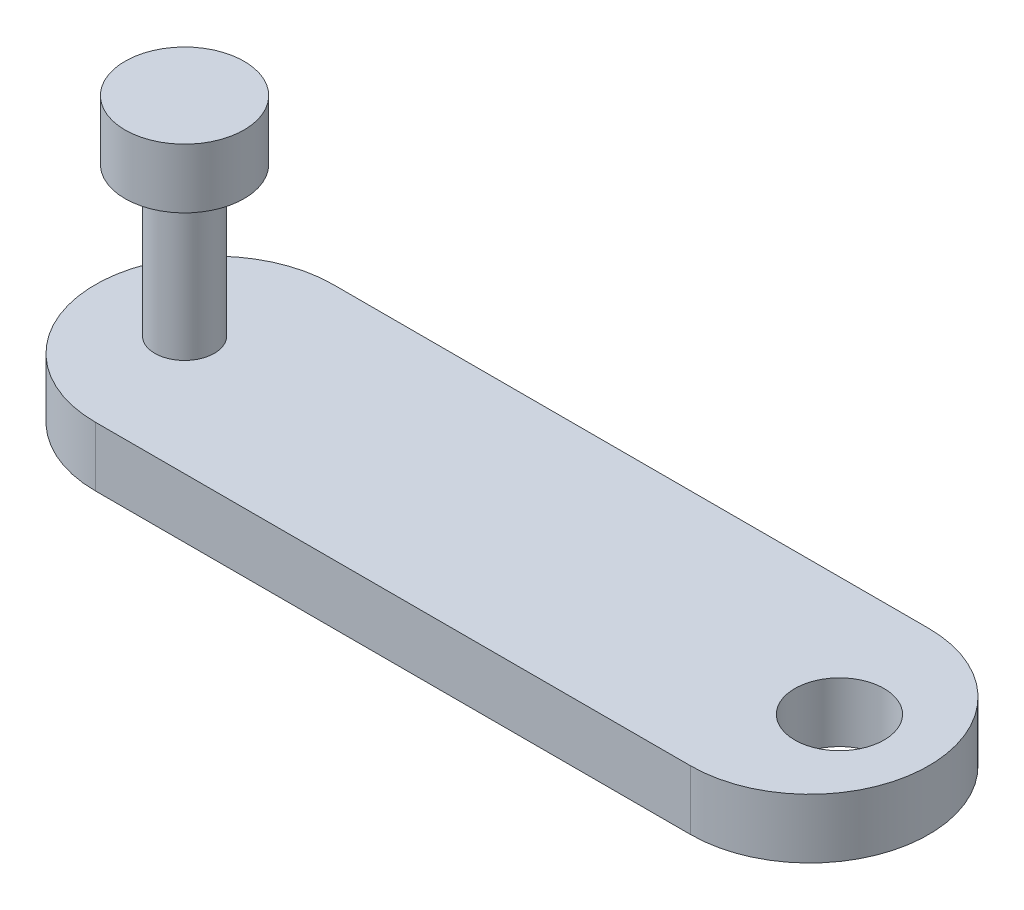
from build123d import *

# Parameters (mm, degrees)
BATON_DEPTH       = 2.54
SKETCH2_R         = 1.27
JOIN_DEPTH        = 6.35
SKETCH4_R         = 2.54
JOINER_CAP_DEPTH  = 2.54
SKETCH5_R         = 1.905
JOINER_HOLE_DEPTH = 2.54


with BuildPart() as part:
    # Sketch1 → baton (new body)
    with BuildSketch(Plane(origin=(0, 0, 0), x_dir=(1, 0, 0), z_dir=(0, 1, 0))):
        with BuildLine():
            Line((-12.7, 5.08), (12.7, 5.08))
            ThreePointArc((12.7, 5.08), (17.78, 0), (12.7, -5.08))
            Line((12.7, -5.08), (-12.7, -5.08))
            ThreePointArc((-12.7, -5.08), (-17.78, 0), (-12.7, 5.08))
        make_face()
    extrude(amount=BATON_DEPTH)

    # Sketch2 → join (add)
    with BuildSketch(Plane(origin=(0, 2.54, 0), x_dir=(1, 0, 0), z_dir=(0, 1, 0))):
        with Locations(Location((-13.97, 0, 0), (0, 0, 270))):
            Circle(SKETCH2_R)
    extrude(amount=JOIN_DEPTH)

    # Sketch4 → joiner cap (add)
    with BuildSketch(Plane(origin=(0, 8.89, 0), x_dir=(1, 0, 0), z_dir=(0, 1, 0))):
        with Locations(Location((-13.97, 0, 0), (0, 0, 270))):
            Circle(SKETCH4_R)
    extrude(amount=JOINER_CAP_DEPTH)

    # Sketch5 → joiner hole (cut)
    with BuildSketch(Plane(origin=(0, 2.54, 0), x_dir=(1, 0, 0), z_dir=(0, 1, 0))):
        with Locations(Location((13.97, 0, 0), (0, 0, 270))):
            Circle(SKETCH5_R)
    extrude(amount=-JOINER_HOLE_DEPTH, mode=Mode.SUBTRACT)


solid = part.part
